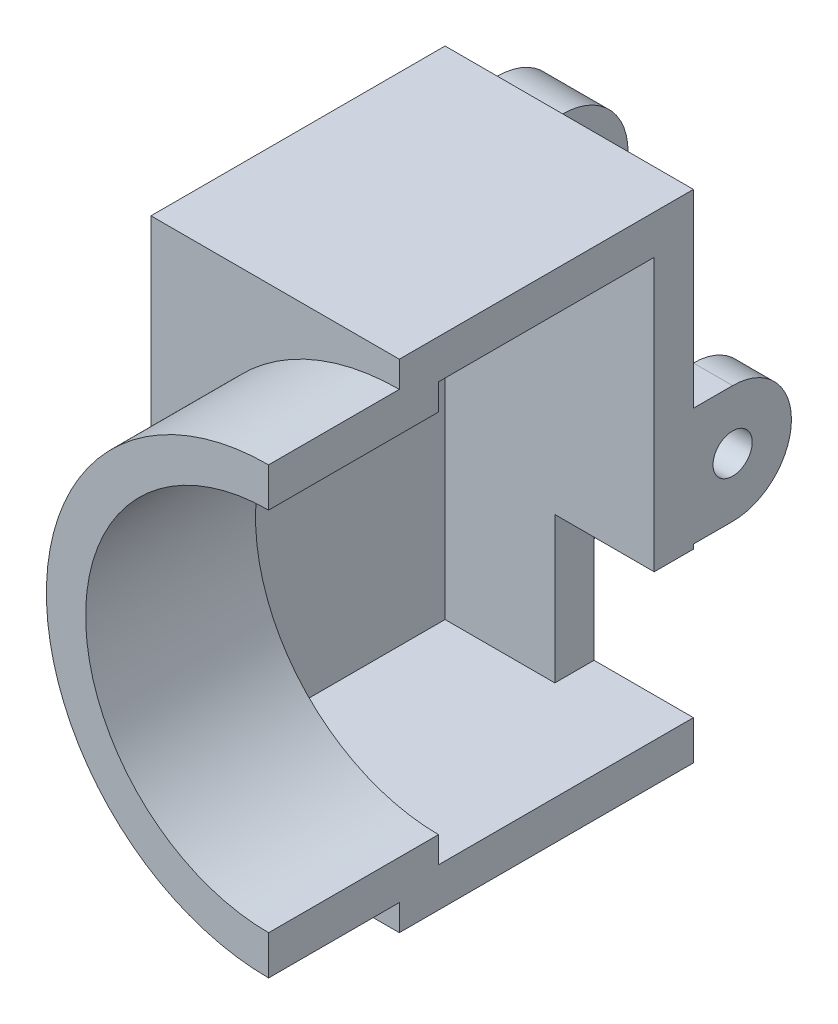
from build123d import *

# Parameters (mm, degrees)
SKETCH_1_R               = 17
SKETCH_1_R_2             = 14
EXTRUDE_1_DEPTH          = 10
SKETCH_2_W               = 38
SKETCH_2_H               = 38
EXTRUDE_2_DEPTH          = 22.5
SKETCH_3_W               = 32
SKETCH_3_H               = 32
CUT_EXTRUDE_1_DEPTH      = 19.5
SKETCH_4_R               = 14
CUT_EXTRUDE_2_DEPTH      = 36.046397818
SKETCH_5_W               = 38
SKETCH_5_H               = 38
SKETCH_5_W_2             = 12.1
SKETCH_5_H_2             = 11.16
EXTRUDE_3_DEPTH          = 3
SKETCH_6_R               = 1.5
EXTRUDE_4_DEPTH          = 3
SKETCH_7_R               = 1.5
EXTRUDE_5_DEPTH          = 5
CUT_EXTRUDE_3_DEPTH      = 2
CUT_EXTRUDE_5_DEPTH      = 43.16930163
CUT_EXTRUDE_5_DEPTH_BACK = 43.16930163
SKETCH_9_W               = 32.496021676
SKETCH_9_H               = 55.588041179


with BuildPart() as part:
    # 草图1 → 凸台-拉伸1 (new body)
    with BuildSketch(Plane.XY):
        Circle(SKETCH_1_R)
        Circle(SKETCH_1_R_2, mode=Mode.SUBTRACT)
    extrude(amount=EXTRUDE_1_DEPTH)

    # 草图2 → 凸台-拉伸2 (add)
    with BuildSketch(Plane(origin=(0, 0, 0), x_dir=(-1, 0, 0), z_dir=(0, 0, -1))):
        Rectangle(SKETCH_2_W, SKETCH_2_H)
    extrude(amount=EXTRUDE_2_DEPTH)

    # 草图3 → 切除-拉伸1 (cut)
    with BuildSketch(Plane(origin=(0, 0, -22.5), x_dir=(-1, 0, 0), z_dir=(0, 0, -1))):
        Rectangle(SKETCH_3_W, SKETCH_3_H)
    extrude(amount=-CUT_EXTRUDE_1_DEPTH, mode=Mode.SUBTRACT)

    # 草图4 → 切除-拉伸2 (cut, through all)
    with BuildSketch(Plane.XY):
        Circle(SKETCH_4_R)
    extrude(amount=-CUT_EXTRUDE_2_DEPTH, mode=Mode.SUBTRACT)

    # 草图5 → 凸台-拉伸3 (add)
    with BuildSketch(Plane(origin=(0, 0, -22.5), x_dir=(-1, 0, 0), z_dir=(0, 0, -1))):
        Rectangle(SKETCH_5_W, SKETCH_5_H)
        with Locations((1.55, -10.42)):
            Rectangle(SKETCH_5_W_2, SKETCH_5_H_2, mode=Mode.SUBTRACT)
    extrude(amount=-EXTRUDE_3_DEPTH)

    # 草图6 → 凸台-拉伸4 (add, symmetric)
    with BuildSketch(Plane(origin=(0, 0, 0), x_dir=(0, 0, -1), z_dir=(1, 0, 0))):
        with BuildLine():
            Line((22.5, 4.5), (25.5, 4.5))
            ThreePointArc((25.5, 4.5), (30, 0), (25.5, -4.5))
            Line((25.5, -4.5), (22.5, -4.5))
            Line((22.5, -4.5), (22.5, 4.5))
        make_face()
        with Locations((25.5, 0)):
            Circle(SKETCH_6_R, mode=Mode.SUBTRACT)
    extrude(amount=EXTRUDE_4_DEPTH, both=True)

    # 草图7 → 凸台-拉伸5 (add)
    # profile 1 of 2: a face of its own
    with BuildSketch(Plane(origin=(19, 0, 0), x_dir=(0, 0, -1), z_dir=(1, 0, 0))):
        with BuildLine():
            Line((22.5, 15), (26.5, 15))
            ThreePointArc((26.5, 15), (31.5, 10), (26.5, 5))
            Line((26.5, 5), (22.5, 5))
            Line((22.5, 5), (22.5, 15))
        make_face()
        with Locations((26.5, 10)):
            Circle(SKETCH_7_R, mode=Mode.SUBTRACT)
    # profile 2 of 2: a face of its own
    with BuildSketch(Plane(origin=(19, 0, 0), x_dir=(0, 0, -1), z_dir=(1, 0, 0))):
        with BuildLine():
            Line((22.5, -5), (22.5, -15))
            Line((22.5, -15), (26.5, -15))
            ThreePointArc((26.5, -15), (31.5, -10), (26.5, -5))
            Line((26.5, -5), (22.5, -5))
        make_face()
        with Locations(Location((26.5, -10, 0), (0, 0, 180))):
            Circle(SKETCH_7_R, mode=Mode.SUBTRACT)
    extrude_5 = extrude(amount=-EXTRUDE_5_DEPTH)

    # 草图8 → 切除-拉伸3 (cut)
    with BuildSketch(Plane.ZY.offset(-14)):
        Polygon((-26.5, 6.824573519), (-23.75, 8.41228676), (-23.75, 11.58771324), (-26.5, 13.175426481), (-29.25, 11.58771324), (-29.25, 8.41228676), align=None)
        Polygon((-29.25, -8.41228676), (-26.5, -6.824573519), (-23.75, -8.41228676), (-23.75, -11.58771324), (-26.5, -13.175426481), (-29.25, -11.58771324), align=None)
    cut_extrude_3 = extrude(amount=-CUT_EXTRUDE_3_DEPTH, mode=Mode.SUBTRACT)

    # 镜向1: 凸台-拉伸5, 切除-拉伸3 across plane
    add(extrude_5.mirror(Plane(origin=(0, 0, 0), x_dir=(0, 0, 1), z_dir=(1, 0, 0))))
    add(cut_extrude_3.mirror(Plane(origin=(0, 0, 0), x_dir=(0, 0, 1), z_dir=(1, 0, 0))), mode=Mode.SUBTRACT)

    # 草图9 → 切除-拉伸5 (cut, two sides: drawn at the far end of the back side and taken through both)
    with BuildSketch(Plane(origin=(0, 0, -22.5), x_dir=(-1, 0, 0), z_dir=(0, 0, -1)).offset(-CUT_EXTRUDE_5_DEPTH_BACK)):
        with Locations((-16.248010838, -0.196580563)):
            Rectangle(SKETCH_9_W, SKETCH_9_H)
    extrude(amount=CUT_EXTRUDE_5_DEPTH + CUT_EXTRUDE_5_DEPTH_BACK, mode=Mode.SUBTRACT)


solid = part.part
